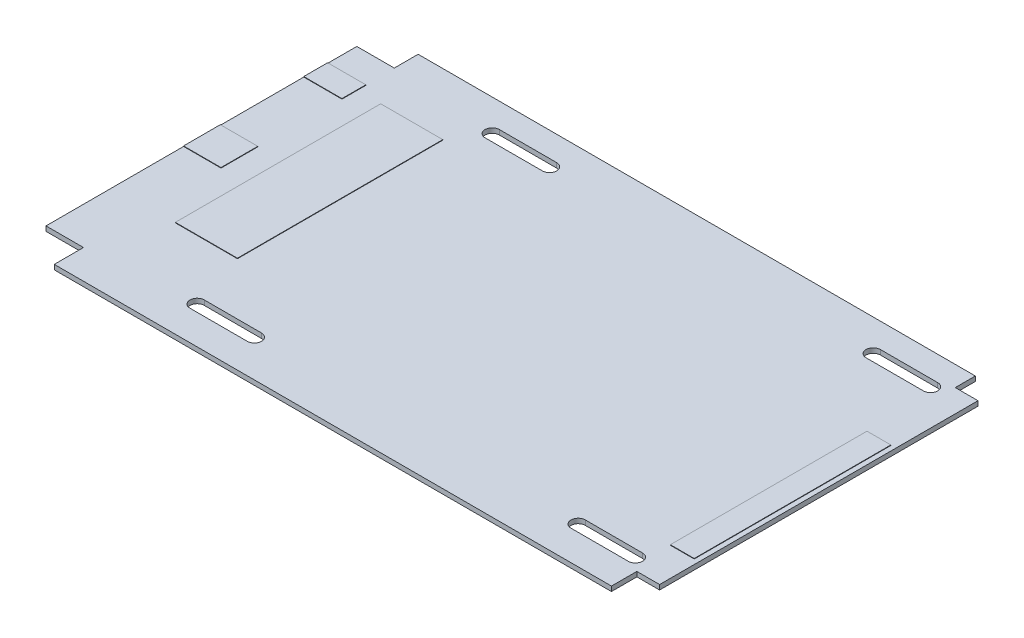
from build123d import *

# Parameters (mm, degrees)
EXTRUIR1_DEPTH = 0.5
EXTRUIR2_DEPTH = 135.945083127
CROQUIS3_W     = 7.84225
CROQUIS3_H     = 7.7
CROQUIS3_W_2   = 13
CROQUIS3_H_2   = 43
CROQUIS3_W_3   = 8
CROQUIS3_H_3   = 5
CROQUIS3_W_4   = 5
CROQUIS3_H_4   = 41.175
EXTRUIR3_DEPTH = 0.1


with BuildPart() as part:
    # Croquis1 → Extruir1 (new, symmetric)
    with BuildSketch(Plane(origin=(0, 0, 0), x_dir=(1, 0, 0), z_dir=(0, 1, 0))):
        Polygon((7.84225, -38.65625), (7.84225, -32.54375), (0, -32.54375), (0, 32.54375), (7.84225, 32.54375), (7.84225, 37.54375), (124.5235, 37.54375), (124.5235, 33.3375), (129.286, 33.3375), (129.286, -33.3375), (124.5235, -33.3375), (124.5235, -38.65625), align=None)
    extrude(amount=EXTRUIR1_DEPTH, both=True)

    # Croquis2 → Extruir2 (cut, through all)
    with BuildSketch(Plane(origin=(0, 0.5, 0), x_dir=(1, 0, 0), z_dir=(0, 1, 0))):
        with BuildLine():
            Line((30, 32.4), (42, 32.4))
            ThreePointArc((42, 32.4), (43.5, 30.9), (42, 29.4))
            Line((42, 29.4), (30, 29.4))
            ThreePointArc((30, 29.4), (28.5, 30.9), (30, 32.4))
        make_face()
        with BuildLine():
            Line((109.786, 32.4), (121.786, 32.4))
            ThreePointArc((121.786, 32.4), (123.286, 30.9), (121.786, 29.4))
            Line((121.786, 29.4), (109.786, 29.4))
            ThreePointArc((109.786, 29.4), (108.286, 30.9), (109.786, 32.4))
        make_face()
    extruir2 = extrude(amount=-EXTRUIR2_DEPTH, mode=Mode.SUBTRACT)

    # Simetría1: Extruir2 across plane
    add(extruir2.mirror(Plane.XY), mode=Mode.SUBTRACT)

    # Croquis3 → Extruir3 (add)
    with BuildSketch(Plane(origin=(0, 0.5, 0), x_dir=(1, 0, 0), z_dir=(0, 1, 0))):
        with Locations((3.921125, 0.1124)):
            Rectangle(CROQUIS3_W, CROQUIS3_H)
        with Locations((19.5, 3.04375)):
            Rectangle(CROQUIS3_W_2, CROQUIS3_H_2)
        with Locations((4, 23.93125)):
            Rectangle(CROQUIS3_W_3, CROQUIS3_H_3)
        with Locations((125.786, -4.5)):
            Rectangle(CROQUIS3_W_4, CROQUIS3_H_4)
    extrude(amount=EXTRUIR3_DEPTH)


solid = part.part
